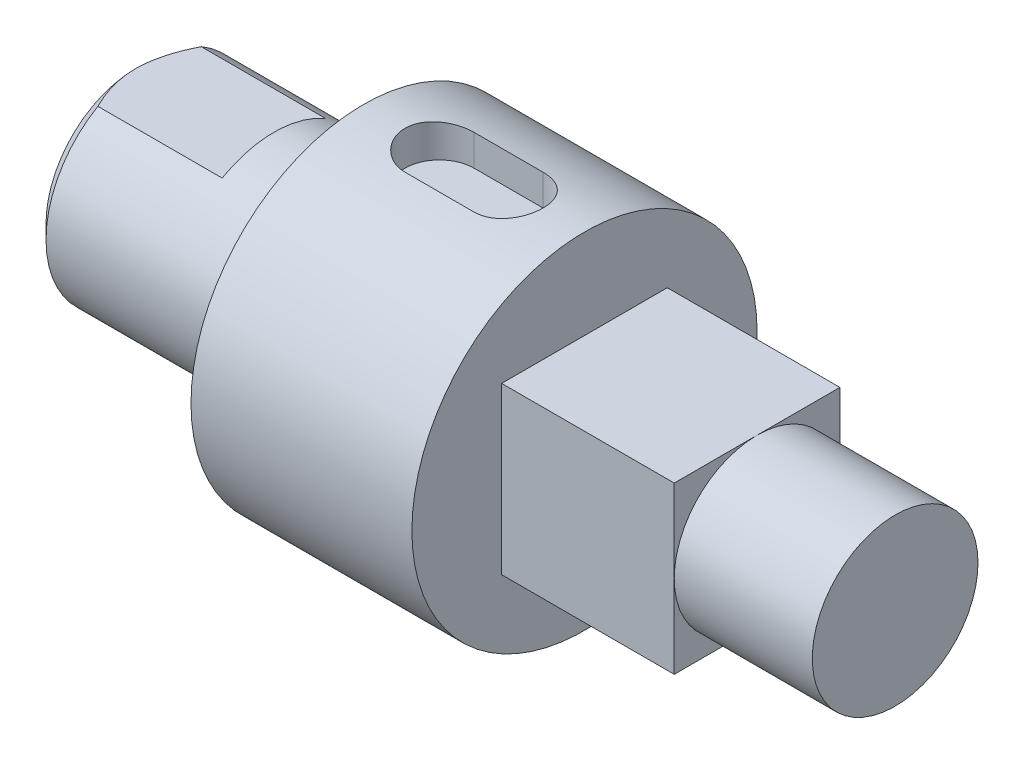
from build123d import *

# Parameters (mm, degrees)
SKETCH1_R           = 25
BOSS_EXTRUDE1_DEPTH = 110
SKETCH2_OUTSIDE_W   = 78.154
SKETCH2_OUTSIDE_H   = 78.154
SKETCH2_OUTSIDE_W_2 = 24
SKETCH2_OUTSIDE_H_2 = 24
CUT_EXTRUDE1_DEPTH  = 45
SKETCH3_OUTSIDE_W   = 78.154
SKETCH3_OUTSIDE_H   = 78.154
SKETCH3_OUTSIDE_R   = 12
CUT_EXTRUDE2_DEPTH  = 20
SKETCH4_OUTSIDE_W   = 78.154
SKETCH4_OUTSIDE_H   = 78.154
SKETCH4_OUTSIDE_R   = 15
CUT_EXTRUDE3_DEPTH  = 33
CHAMFER1_SIZE       = 2
SKETCH5_W           = 20
SKETCH5_H           = 16
CUT_EXTRUDE4_DEPTH  = 2
CUT_EXTRUDE5_DEPTH  = 5


with BuildPart() as part:
    # Sketch1 → Boss-Extrude1 (new body)
    with BuildSketch(Plane(origin=(0, 0, 0), x_dir=(0, 0, -1), z_dir=(1, 0, 0))):
        Circle(SKETCH1_R)
    extrude(amount=BOSS_EXTRUDE1_DEPTH)

    # Sketch2 outside → Cut-Extrude1 (cut)
    with BuildSketch(Plane(origin=(110, 0, 0), x_dir=(0, 0, -1), z_dir=(1, 0, 0))):
        Rectangle(SKETCH2_OUTSIDE_W, SKETCH2_OUTSIDE_H)
        Rectangle(SKETCH2_OUTSIDE_W_2, SKETCH2_OUTSIDE_H_2, mode=Mode.SUBTRACT)
    extrude(amount=-CUT_EXTRUDE1_DEPTH, mode=Mode.SUBTRACT)

    # Sketch3 outside → Cut-Extrude2 (cut)
    with BuildSketch(Plane(origin=(110, 0, 0), x_dir=(0, 0, -1), z_dir=(1, 0, 0))):
        Rectangle(SKETCH3_OUTSIDE_W, SKETCH3_OUTSIDE_H)
        Circle(SKETCH3_OUTSIDE_R, mode=Mode.SUBTRACT)
    extrude(amount=-CUT_EXTRUDE2_DEPTH, mode=Mode.SUBTRACT)

    # Sketch4 outside → Cut-Extrude3 (cut)
    with BuildSketch(Plane.ZY):
        Rectangle(SKETCH4_OUTSIDE_W, SKETCH4_OUTSIDE_H)
        Circle(SKETCH4_OUTSIDE_R, mode=Mode.SUBTRACT)
    extrude(amount=-CUT_EXTRUDE3_DEPTH, mode=Mode.SUBTRACT)

    # Chamfer1
    chamfer1_edges = [part.edges().sort_by_distance(p)[0] for p in [
        (0, 0, -15),
    ]]
    chamfer(chamfer1_edges, length=CHAMFER1_SIZE)

    # Sketch5 → Cut-Extrude4 (cut)
    with BuildSketch(Plane(origin=(0, 15, 0), x_dir=(1, 0, 0), z_dir=(0, 1, 0))):
        with Locations((10, 0)):
            Rectangle(SKETCH5_W, SKETCH5_H)
    extrude(amount=-CUT_EXTRUDE4_DEPTH, mode=Mode.SUBTRACT)

    # Sketch6 → Cut-Extrude5 (cut)
    with BuildSketch(Plane(origin=(0, 25, 0), x_dir=(1, 0, 0), z_dir=(0, 1, 0))):
        with BuildLine():
            Line((44, -5), (54, -5))
            ThreePointArc((54, -5), (59, 0), (54, 5))
            Line((54, 5), (44, 5))
            ThreePointArc((44, 5), (39, 0), (44, -5))
        make_face()
    extrude(amount=-CUT_EXTRUDE5_DEPTH, mode=Mode.SUBTRACT)


solid = part.part
